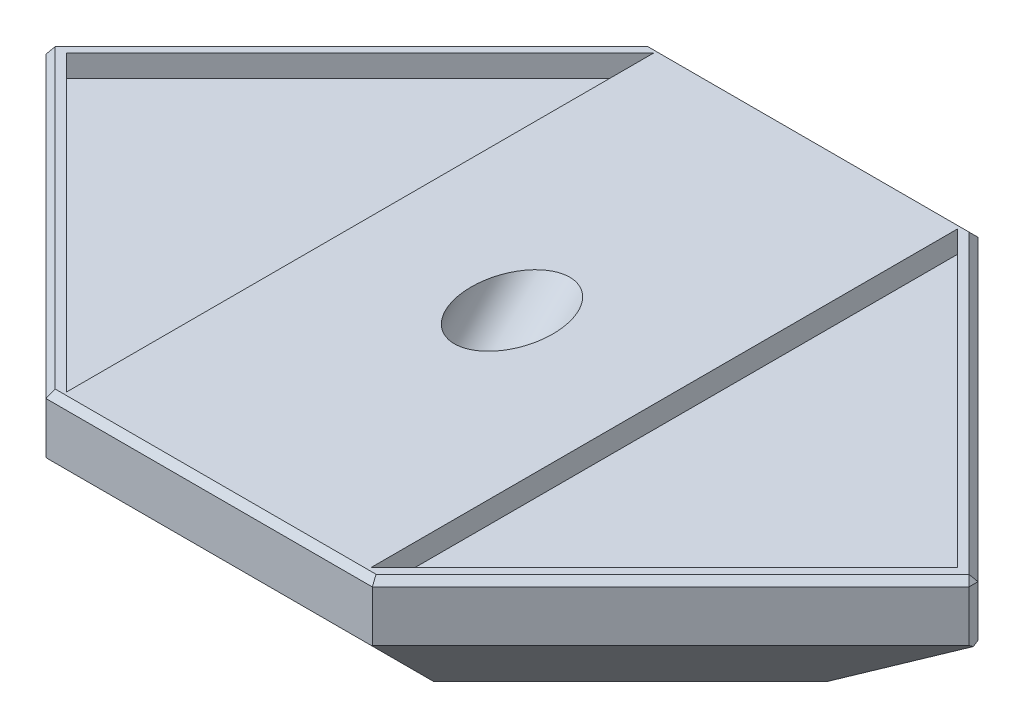
from build123d import *

# Parameters (mm, degrees)
BOSS_EXTRUDE1_DEPTH     = 76.2
CHAMFER1_SIZE           = 16.51
CHAMFER2_SIZE           = 1
CUT_EXTRUDE1_DEPTH      = 3.425
SKETCH5_R               = 1.905
CUT_EXTRUDE2_DEPTH      = 114.174020707
CUT_EXTRUDE3_DEPTH      = 118.371627589
CUT_EXTRUDE3_DEPTH_BACK = 12.7
SKETCH6_R               = 6.35
SKETCH5_3_R             = 3.81
CUT_EXTRUDE4_DEPTH      = 12.7


with BuildPart() as part:
    # Sketch1 → Boss-Extrude1 (new body)
    with BuildSketch(Plane(origin=(0, 0, 0), x_dir=(1, 0, 0), z_dir=(0, 1, 0))):
        Polygon((-25.4, 47.146344636), (25.4, 47.146344636), (72.546344636, 0), (25.4, -47.146344636), (-25.4, -47.146344636), (-72.546344636, 0), align=None)
    extrude(amount=BOSS_EXTRUDE1_DEPTH)

    # SurfaceCut1
    split(bisect_by=Plane(origin=(0, 10.036699622, 10.036699622), x_dir=(-1, 0, 0), z_dir=(0, 0.7071067811865464, 0.7071067811865488)), keep=Keep.TOP)

    # SurfaceCut2
    split(bisect_by=Plane(origin=(0, 10.036699622, -10.036699622), x_dir=(1, 0, 0), z_dir=(0, 0.7071067811865464, -0.7071067811865488)), keep=Keep.TOP)

    # SurfaceCut3
    split(bisect_by=Plane(origin=(0, 50.8, 0), x_dir=(1, 0, 0), z_dir=(0, 1, 0)), keep=Keep.TOP)

    # Chamfer1
    chamfer1_edges = [part.edges().sort_by_distance(p)[0] for p in [
        (-57.183044257, 50.8, 15.363300378),
        (-57.183044257, 50.8, -15.363300378),
        (57.183044257, 50.8, 15.363300378),
        (57.183044257, 50.8, -15.363300378),
    ]]
    chamfer(chamfer1_edges, length=CHAMFER1_SIZE)

    # Chamfer2
    chamfer2_edges = [part.edges().sort_by_distance(p)[0] for p in [
        (72.546344636, 71.755, 0),
        (-72.546344636, 71.755, 0),
        (0, 76.2, 47.146344636),
        (48.973172318, 76.2, 23.573172318),
        (48.973172318, 76.2, -23.573172318),
        (0, 76.2, -47.146344636),
        (-48.973172318, 76.2, -23.573172318),
        (-48.973172318, 76.2, 23.573172318),
    ]]
    chamfer(chamfer2_edges, length=CHAMFER2_SIZE)

    # Sketch2 → Cut-Extrude1 (cut)
    with BuildSketch(Plane(origin=(0, 76.2, 0), x_dir=(1, 0, 0), z_dir=(0, 1, 0))):
        Polygon((-23.68275885, 45.681605271), (-69.36436412, 0), (-23.682753383, -45.681610738), align=None)
        Polygon((69.36436412, 0), (23.682756199, 45.681607921), (23.682745222, -45.681618898), align=None)
    extrude(amount=-CUT_EXTRUDE1_DEPTH, mode=Mode.SUBTRACT)

    # Sketch5 → Cut-Extrude2 (cut, through all)
    with BuildSketch(Plane(origin=(0, 10.036699622, -10.036699622), x_dir=(1, 0, 0), z_dir=(0, 0.7071067811865464, -0.7071067811865488))):
        with Locations(Location((0, -53.881536726, 0), (0, 0, 270))):
            Circle(SKETCH5_R)
    extrude(amount=CUT_EXTRUDE2_DEPTH, mode=Mode.SUBTRACT)

    # Sketch6 → Cut-Extrude3 (cut, two sides: drawn at the far end of the back side and taken through both)
    with BuildSketch(Plane(origin=(0, 36.977467985, -36.977467985), x_dir=(1, 0, 0), z_dir=(0, 0.7071067811865464, -0.7071067811865488)).offset(-CUT_EXTRUDE3_DEPTH_BACK)):
        with Locations(Location((0, -53.881536726, 0), (0, 0, 270))):
            Circle(SKETCH6_R)
    extrude(amount=CUT_EXTRUDE3_DEPTH + CUT_EXTRUDE3_DEPTH_BACK, mode=Mode.SUBTRACT)

    # Sketch5<3> → Cut-Extrude4 (cut)
    with BuildSketch(Plane(origin=(0, 10.036699622, -10.036699622), x_dir=(1, 0, 0), z_dir=(0, 0.7071067811865464, -0.7071067811865488))):
        with Locations(Location((0, -53.881536726, 0), (0, 0, 278.668745784))):
            Circle(SKETCH5_3_R)
    extrude(amount=CUT_EXTRUDE4_DEPTH, mode=Mode.SUBTRACT)


solid = part.part
